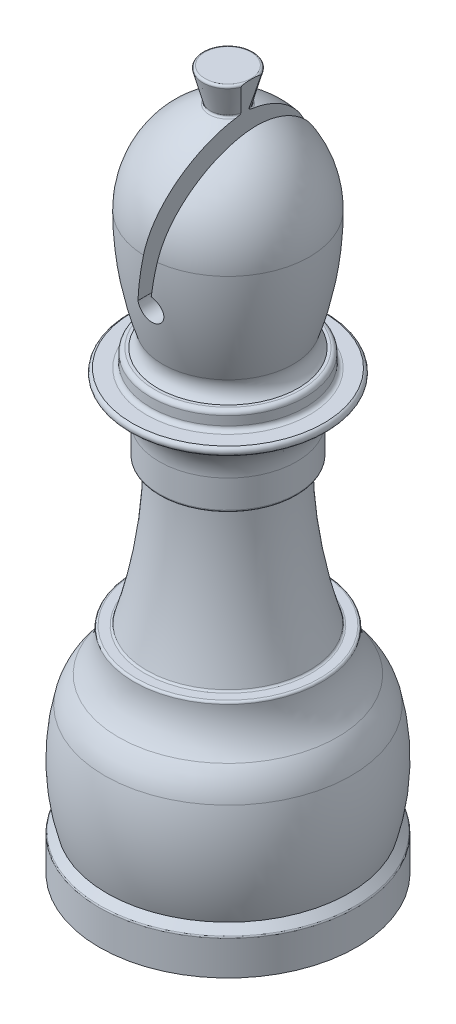
from build123d import *

# Parameters (mm, degrees)
CUT_EXTRUDE1_DEPTH      = 85.215497519
CUT_EXTRUDE1_DEPTH_BACK = 85.215497519
SCALE1_SCALE            = 0.766666667
CUT_EXTRUDE2_DEPTH      = 65.565214795
CUT_EXTRUDE2_DEPTH_BACK = 7
SKETCH3_R               = 10.2
SKETCH6_W               = 10.75
SKETCH6_H               = 1


with BuildPart() as part:
    # Sketch1 → Revolve1 (revolve)
    with BuildSketch(Plane.XY, mode=Mode.PRIVATE) as revolve1_sk:
        with BuildLine():
            Line((0, 81.5), (-2.674193657, 81.5))
            ThreePointArc((-2.674193657, 81.5), (-2.872531992, 81.402190357), (-2.915675113, 81.185295239))
            Line((-2.915675113, 81.185295239), (-2.039838083, 77.916626942))
            ThreePointArc((-2.039838083, 77.916626942), (-2.058203911, 77.739141791), (-2.190227634, 77.619108382))
            ThreePointArc((-2.190227634, 77.619108382), (-7.498358221, 73.392820344), (-9.5, 66.909673646))
            ThreePointArc((-9.5, 66.909673646), (-9.022273487, 60.942994015), (-7.601265823, 55.128337906))
            ThreePointArc((-7.601265823, 55.128337906), (-7.569417538, 53.977648242), (-8.177123449, 53.00000079))
            Line((-8.177123449, 53.00000079), (-8.5, 53.00000079))
            ThreePointArc((-8.5, 53.00000079), (-8.853553391, 52.85355418), (-9, 52.50000079))
            Line((-9, 52.50000079), (-9, 51.469798658))
            ThreePointArc((-9, 51.469798658), (-9.146446609, 51.116245267), (-9.5, 50.969798658))
            Line((-9.5, 50.969798658), (-11.17114094, 50.969798658))
            ThreePointArc((-11.17114094, 50.969798658), (-11.5, 50.5), (-11.17114094, 50.030201342))
            ThreePointArc((-11.17114094, 50.030201342), (-8.871560383, 48.264907732), (-8, 45.5))
            Line((-8, 45.5), (-8, 42.25))
            ThreePointArc((-8, 42.25), (-7.926776695, 42.073223305), (-7.75, 42))
            Line((-7.75, 42), (-7.25, 42))
            ThreePointArc((-7.25, 42), (-7.072844439, 41.926397016), (-7.000002302, 41.748927259))
            ThreePointArc((-7.000002302, 41.748927259), (-7.638690703, 33.374674773), (-9.469707161, 25.178126334))
            ThreePointArc((-9.469707161, 25.178126334), (-9.559935457, 25.049415334), (-9.709152721, 25))
            Line((-9.709152721, 25), (-10.709152721, 25))
            ThreePointArc((-10.709152721, 25), (-10.885929416, 24.926776695), (-10.959152721, 24.75))
            ThreePointArc((-10.959152721, 24.75), (-11.423225699, 22.243676405), (-12.753912139, 20.069671969))
            ThreePointArc((-12.753912139, 20.069671969), (-13.752308854, 18.632010167), (-14.362830433, 16.991604468))
            ThreePointArc((-14.362830433, 16.991604468), (-14.994392071, 10.979343909), (-14.103553391, 5))
            Line((-14.103553391, 5), (-14.926776695, 4.176776695))
            ThreePointArc((-14.926776695, 4.176776695), (-14.980969883, 4.095670858), (-15, 4))
            Line((-15, 4), (-15, 0))
            Line((-15, 0), (0, 0))
            Line((0, 0), (0, 81.5))
        make_face()
    revolve(revolve1_sk.sketch.rotate(Axis((0, 0, 0), (0, -1, 0)), 270), axis=Axis((0, 0, 0), (0, -1, 0)))

    # Sketch2 → Cut-Extrude1 (cut, two sides: drawn at the far end of the back side and taken through both)
    with BuildSketch(Plane.XY.offset(-CUT_EXTRUDE1_DEPTH_BACK)):
        with BuildLine():
            Line((0.916437555, 65.653839061), (0.343856243, 62.960055781))
            ThreePointArc((0.343856243, 62.960055781), (0.931186242, 60.324035637), (-1.5, 61.5))
            Line((-1.5, 61.5), (-0.590117131, 65.780662339))
            Line((-0.590117131, 65.780662339), (1.945867371, 77.711531388))
            Line((1.945867371, 77.711531388), (2.777514135, 81.624121791))
            Line((2.777514135, 81.624121791), (4.24473641, 81.312254069))
            Line((4.24473641, 81.312254069), (3.347434573, 77.09078083))
            Line((3.347434573, 77.09078083), (0.916437555, 65.653839061))
        make_face()
    extrude(amount=CUT_EXTRUDE1_DEPTH + CUT_EXTRUDE1_DEPTH_BACK, mode=Mode.SUBTRACT)


with BuildPart() as part_1:
    # Scale1: scaled about (0, 0, 0)
    add(part.part.scale(SCALE1_SCALE))

    # Sketch3 → Cut-Extrude2 (cut, two sides: drawn at the far end of the back side and taken through both)
    with BuildSketch(Plane.XZ.offset(-CUT_EXTRUDE2_DEPTH_BACK)):
        with Locations(Location((0, 0, 0), (0, 0, 90))):
            Circle(SKETCH3_R)
    extrude(amount=CUT_EXTRUDE2_DEPTH + CUT_EXTRUDE2_DEPTH_BACK, mode=Mode.SUBTRACT)

    # Sketch6 → Cut-Revolve1 (revolve, cut)
    with BuildSketch(Plane.XY, mode=Mode.PRIVATE) as cut_revolve1_sk:
        with Locations((-5.375, 0.5)):
            Rectangle(SKETCH6_W, SKETCH6_H)
    revolve(cut_revolve1_sk.sketch.rotate(Axis((0, 0, 0), (0, -1, 0)), 270), axis=Axis((0, 0, 0), (0, -1, 0)), mode=Mode.SUBTRACT)


with BuildPart() as body_2:
    # Sketch8 → Base (White Bishop) (revolve)
    with BuildSketch(Plane.XY, mode=Mode.PRIVATE) as base_white_bishop_sk:
        Polygon((0, 0), (0, 4.5), (-10, 4.5), (-10, 1), (-10.55, 1), (-10.55, 0), align=None)
    revolve(base_white_bishop_sk.sketch.rotate(Axis((0, 0, 0), (0, -1, 0)), 270), axis=Axis((0, 0, 0), (0, -1, 0)))


solid = Compound([part_1.part, body_2.part])
